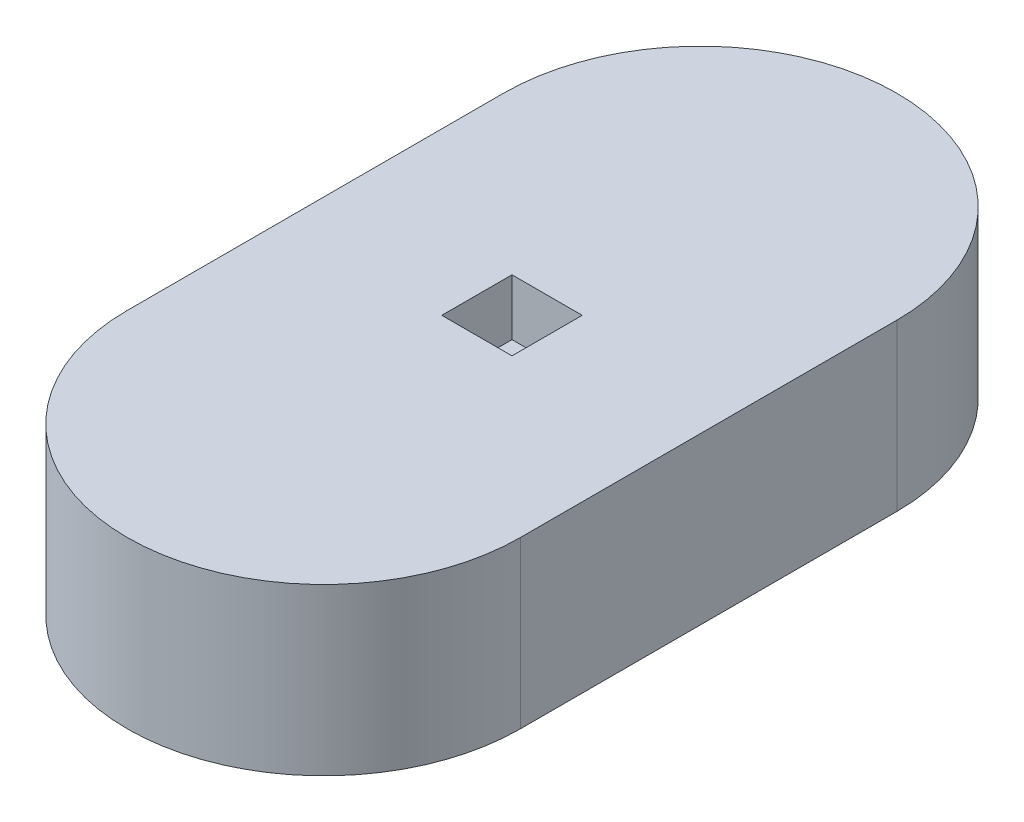
from build123d import *

# Parameters (mm, degrees)
BOSS_EXTRUDE1_DEPTH = 5.9
SKETCH2_W           = 2.5
SKETCH2_H           = 2.5
CUT_EXTRUDE1_DEPTH  = 2


with BuildPart() as part:
    # Sketch1 → Boss-Extrude1 (new body)
    with BuildSketch(Plane(origin=(0, 0, 0), x_dir=(1, 0, 0), z_dir=(0, 1, 0))):
        with BuildLine():
            Line((-7, 0), (-7, 13.4))
            ThreePointArc((-7, 13.4), (0, 20.4), (7, 13.4))
            Line((7, 13.4), (7, 0))
            ThreePointArc((7, 0), (0, -7), (-7, 0))
        make_face()
    extrude(amount=BOSS_EXTRUDE1_DEPTH)

    # Sketch2 → Cut-Extrude1 (cut)
    with BuildSketch(Plane(origin=(0, 5.9, 0), x_dir=(1, 0, 0), z_dir=(0, 1, 0))):
        with Locations((0, 6.7)):
            Rectangle(SKETCH2_W, SKETCH2_H)
    extrude(amount=-CUT_EXTRUDE1_DEPTH, mode=Mode.SUBTRACT)


solid = part.part
